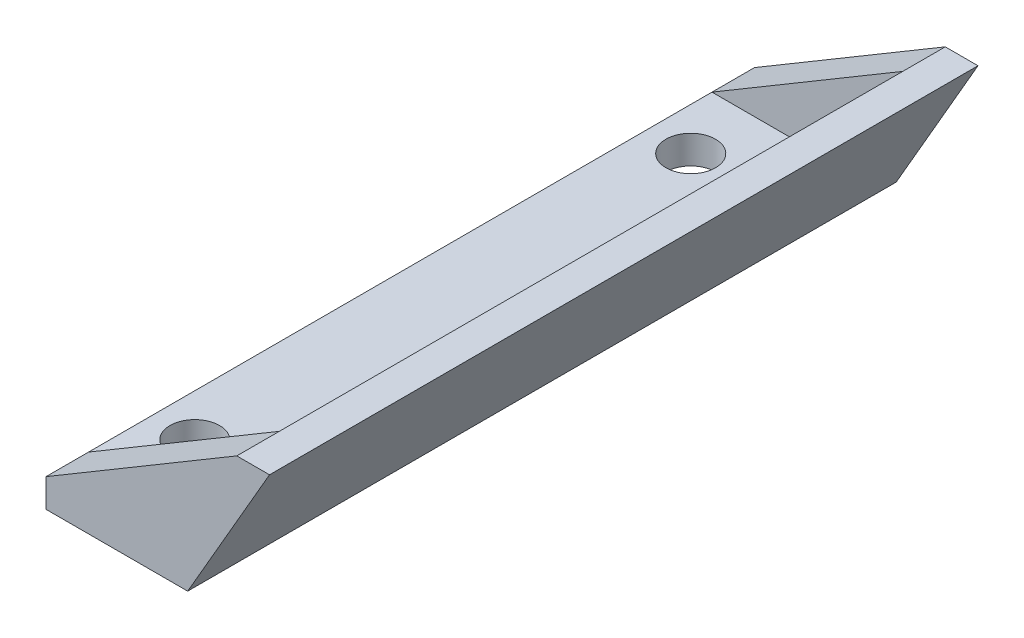
from build123d import *

# Parameters (mm, degrees)
BOSS_EXTRUDE1_DEPTH      = 25
BOSS_EXTRUDE1_DEPTH_BACK = 25
SKETCH2_R                = 1.75
CUT_EXTRUDE1_DEPTH       = 29.722813233
BOSS_EXTRUDE2_DEPTH      = 3


with BuildPart() as part:
    # Sketch1 → Boss-Extrude1 (new, two sides: drawn at the far end of the back side and taken through both)
    with BuildSketch(Plane.XY.offset(-BOSS_EXTRUDE1_DEPTH_BACK)):
        Polygon((-10, 0), (0, 0), (5.773502692, 10), (3.464101615, 10), (-1.154700538, 2), (-10, 2), align=None)
    extrude(amount=BOSS_EXTRUDE1_DEPTH + BOSS_EXTRUDE1_DEPTH_BACK)

    # Sketch2 → Cut-Extrude1 (cut, through all)
    with BuildSketch(Plane.XZ):
        with Locations((-7, 17.5)):
            Circle(SKETCH2_R)
        with Locations((-7, -17.5)):
            Circle(SKETCH2_R)
    extrude(amount=-CUT_EXTRUDE1_DEPTH, mode=Mode.SUBTRACT)

    # Sketch3 → Boss-Extrude2 (add)
    with BuildSketch(Plane(origin=(0, 0, -25), x_dir=(-1, 0, 0), z_dir=(0, 0, -1))):
        Polygon((-3.464101615, 10), (10, 2), (1.154700538, 2), align=None)
    boss_extrude2 = extrude(amount=-BOSS_EXTRUDE2_DEPTH)

    # Mirror1: Boss-Extrude2 across plane
    add(boss_extrude2.mirror(Plane.XY))


solid = part.part
